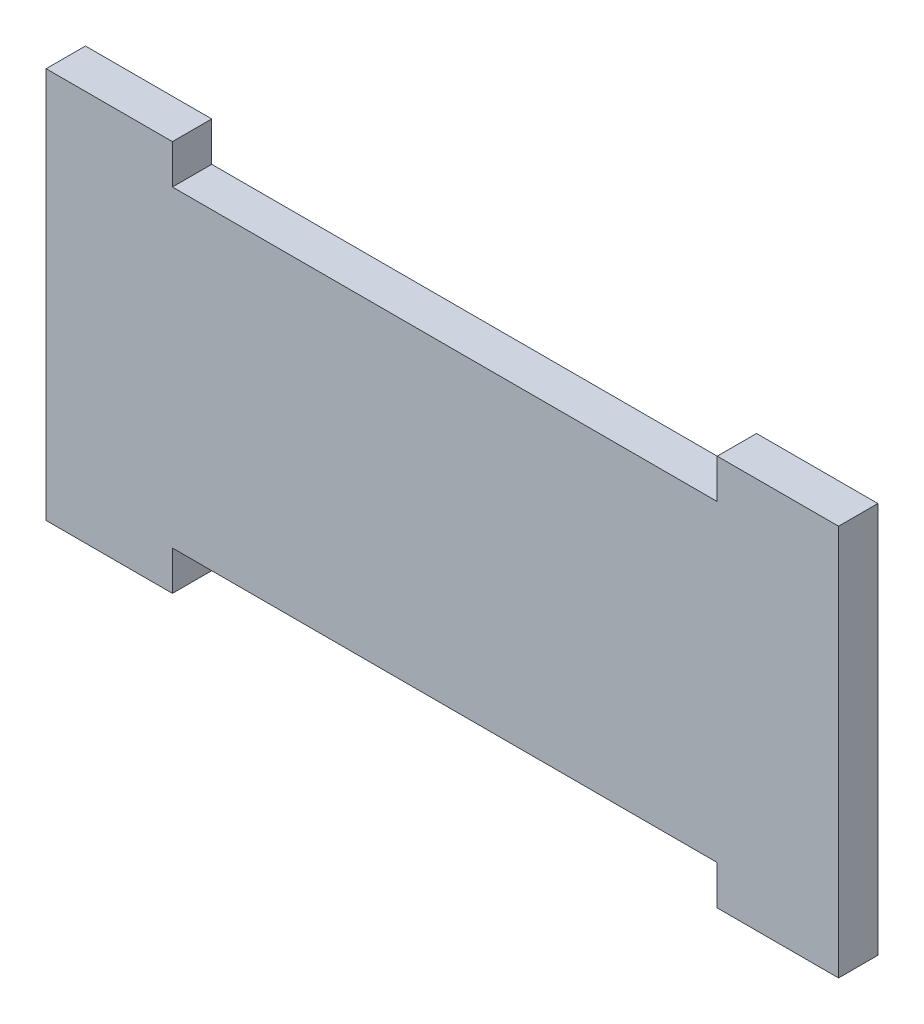
from build123d import *

# Parameters (mm, degrees)
SKETCH2_W           = 5.1
SKETCH2_H           = 1.5875
SKETCH2_W_2         = 4.9
BOSS_EXTRUDE1_DEPTH = 1.5875


with BuildPart() as part:
    # Sketch2 → Boss-Extrude1 (new body)
    with BuildSketch(Plane.XY):
        Polygon((-19, -7.9), (-51, -7.9), (-51, -14.2125), (-45.9, -14.2125), (-23.9, -14.2125), (-19, -14.2125), align=None)
        with Locations((-48.45, -15.00625)):
            Rectangle(SKETCH2_W, SKETCH2_H)
        Polygon((-23.9, -1.5875), (-45.9, -1.5875), (-51, -1.5875), (-51, -7.9), (-19, -7.9), (-19, -1.5875), align=None)
        with Locations((-48.45, -0.79375)):
            Rectangle(SKETCH2_W, SKETCH2_H)
        with Locations((-21.45, -0.79375)):
            Rectangle(SKETCH2_W_2, SKETCH2_H)
        with Locations((-21.45, -15.00625)):
            Rectangle(SKETCH2_W_2, SKETCH2_H)
    extrude(amount=BOSS_EXTRUDE1_DEPTH)


solid = part.part
